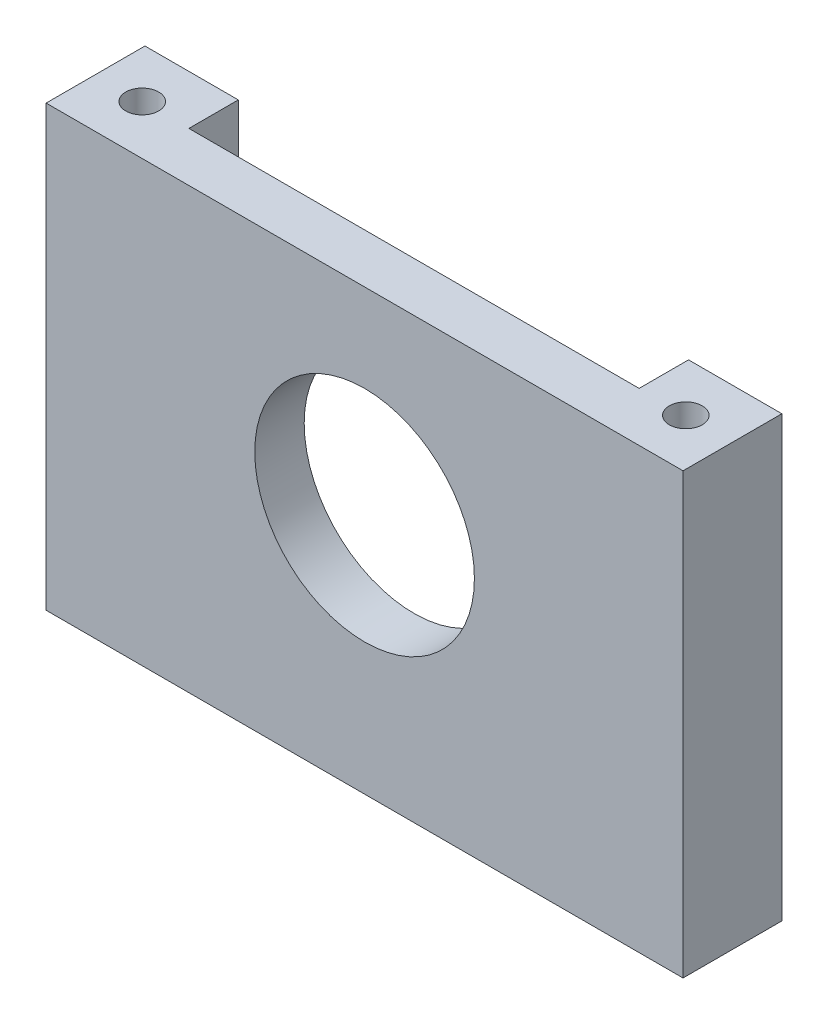
from build123d import *

# Parameters (mm, degrees)
SKETCH1_W           = 58
SKETCH1_H           = 40
SKETCH1_R           = 10
BOSS_EXTRUDE1_DEPTH = 9
SKETCH2_W           = 41
SKETCH2_H           = 40
CUT_EXTRUDE1_DEPTH  = 4.5
SKETCH3_R           = 1.5
CUT_EXTRUDE2_DEPTH  = 51.219518118


with BuildPart() as part:
    # Sketch1 → Boss-Extrude1 (new body)
    with BuildSketch(Plane.XY):
        Rectangle(SKETCH1_W, SKETCH1_H)
        with Locations((0, 2)):
            Circle(SKETCH1_R, mode=Mode.SUBTRACT)
    extrude(amount=BOSS_EXTRUDE1_DEPTH)

    # Sketch2 → Cut-Extrude1 (cut)
    with BuildSketch(Plane(origin=(0, 0, 0), x_dir=(-1, 0, 0), z_dir=(0, 0, -1))):
        Rectangle(SKETCH2_W, SKETCH2_H)
    extrude(amount=-CUT_EXTRUDE1_DEPTH, mode=Mode.SUBTRACT)

    # Sketch3 → Cut-Extrude2 (cut, through all)
    with BuildSketch(Plane(origin=(0, 20, 0), x_dir=(1, 0, 0), z_dir=(0, 1, 0))):
        with Locations(Location((24.75, -4.5, 0), (0, 0, 270))):
            Circle(SKETCH3_R)
        with Locations(Location((-24.75, -4.5, 0), (0, 0, 270))):
            Circle(SKETCH3_R)
    extrude(amount=-CUT_EXTRUDE2_DEPTH, mode=Mode.SUBTRACT)


solid = part.part
